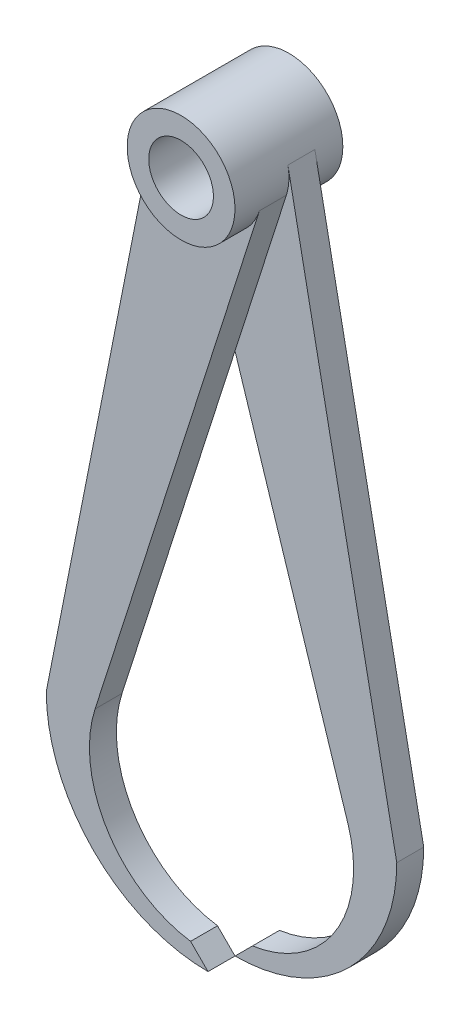
from build123d import *

# Parameters (mm, degrees)
SKETCH1_R            = 6
BOSS_EXTRUDE1_DEPTH  = 10
BOSS_EXTRUDE14_DEPTH = 5
BOSS_EXTRUDE15_DEPTH = 5


with BuildPart() as part:
    # Sketch1 → Boss-Extrude1 (new, symmetric)
    with BuildSketch(Plane.XY):
        with BuildLine():
            ThreePointArc((9.809453986617676, 1.9428361959853027), (6.1e-16, 10.000000000000004), (-9.809453986617676, 1.9428361959853029))
            ThreePointArc((-9.809453986617676, 1.9428361959853029), (-9.983713411106137, -0.5704967352225092), (-9.524285702381553, -3.0476190476190443))
            ThreePointArc((-9.524285702381553, -3.0476190476190443), (-1.84e-15, -10.000000000000004), (9.524285702381551, -3.047619047619048))
            ThreePointArc((9.524285702381551, -3.047619047619048), (9.88035568751995, -1.5422618091920235), (10.000000000000004, -2.45e-15))
            ThreePointArc((10.000000000000004, 0), (9.952249491099408, 0.9760789245299965), (9.809453986617676, 1.9428361959853027))
        make_face()
        Circle(SKETCH1_R, mode=Mode.SUBTRACT)
    extrude(amount=BOSS_EXTRUDE1_DEPTH, both=True)


with BuildPart() as body_2:
    # Sketch1<52> → Boss-Extrude14 (new body)
    with BuildSketch(Plane.XY):
        with BuildLine():
            ThreePointArc((-30, -99.99999999999994), (-21.213203435596444, -121.21320343559641), (2.16e-15, -130))
            Line((0, -130), (-3.239870411273939, -126.76012958872607))
            ThreePointArc((-3.239870411273936, -126.76012958872607), (-18.67863593878897, -116.62362075543508), (-20.953428545239394, -98.29523809523806))
            Line((-20.953428545239394, -98.29523809523806), (9.524285702381551, -3.047619047619051))
            ThreePointArc((9.524285702381553, -3.0476190476190466), (-2.4992981259121687, -9.682639561494172), (-9.809453986617678, 1.942836195985301))
            Line((-9.809453986617676, 1.9428361959853078), (-30, -99.99999999999994))
        make_face()
    extrude(amount=BOSS_EXTRUDE14_DEPTH)


with BuildPart() as body_3:
    # Sketch1<53> → Boss-Extrude15 (new body)
    with BuildSketch(Plane.XY):
        with BuildLine():
            Line((3.2398704112739423, -126.76012958872607), (0, -130))
            ThreePointArc((2.16e-15, -130), (21.213203435596423, -121.21320343559643), (30, -100.00000000000001))
            Line((30, -100), (9.809453986617676, 1.9428361959853078))
            ThreePointArc((9.809453986617676, 1.9428361959853029), (2.49929812591217, -9.682639561494168), (-9.524285702381551, -3.0476190476190474))
            Line((-9.524285702381553, -3.0476190476190483), (20.95342854523939, -98.29523809523812))
            ThreePointArc((20.953428545239394, -98.29523809523812), (18.678635938788954, -116.62362075543511), (3.239870411273943, -126.76012958872607))
        make_face()
    extrude(amount=-BOSS_EXTRUDE15_DEPTH)


solid = Compound([part.part, body_2.part, body_3.part])
